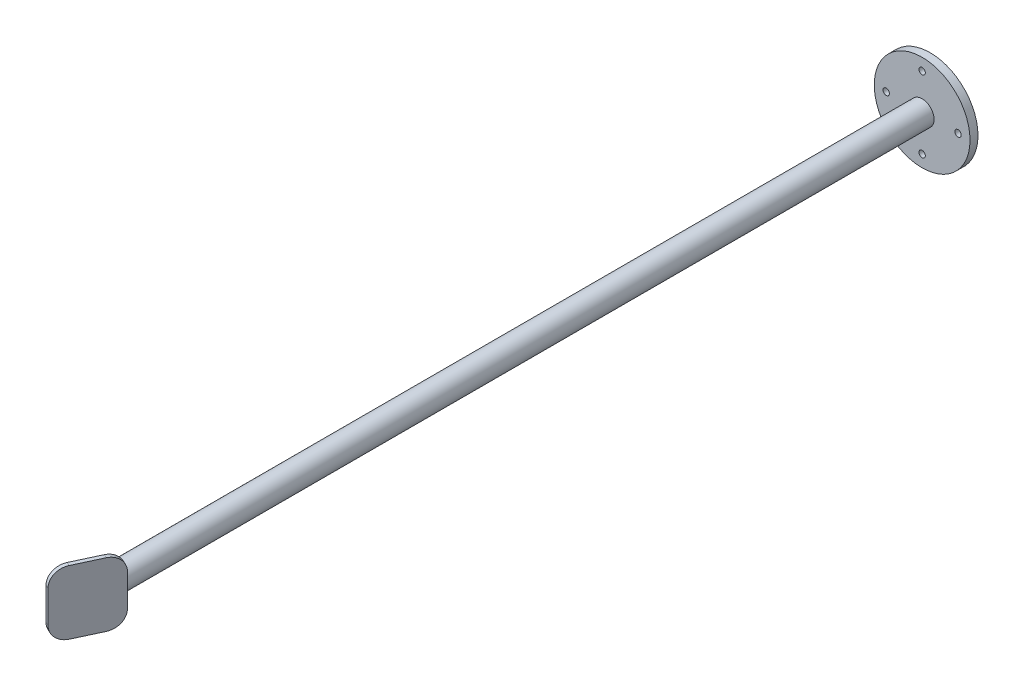
from build123d import *

# Parameters (mm, degrees)
SKETCH1_R           = 60
SKETCH1_R_2         = 4
BOSS_EXTRUDE1_DEPTH = 10
SKETCH2_R           = 15
BOSS_EXTRUDE2_DEPTH = 1080
CUT_EXTRUDE1_REACH  = 1017.827
SKETCH4_W           = 30
SKETCH4_H           = 150
BOSS_EXTRUDE3_DEPTH = 5


with BuildPart() as part:
    # Sketch1 → Boss-Extrude1 (new body)
    with BuildSketch(Plane.XY):
        Circle(SKETCH1_R)
        with Locations((0, 45)):
            Circle(SKETCH1_R_2, mode=Mode.SUBTRACT)
        with Locations((45, 0)):
            Circle(SKETCH1_R_2, mode=Mode.SUBTRACT)
        with Locations((0, -45)):
            Circle(SKETCH1_R_2, mode=Mode.SUBTRACT)
        with Locations((-45, 0)):
            Circle(SKETCH1_R_2, mode=Mode.SUBTRACT)
    extrude(amount=BOSS_EXTRUDE1_DEPTH)

    # Sketch2 → Boss-Extrude2 (add)
    with BuildSketch(Plane.XY.offset(10)):
        Circle(SKETCH2_R)
    extrude(amount=BOSS_EXTRUDE2_DEPTH)

    # Sketch4 → Cut-Extrude1 (cut, up to next)
    with BuildSketch(Plane(origin=(405.173314427, 0, 188.935419397), x_dir=(0, -1, 0), z_dir=(0.906307787036651, 0, 0.4226182617406972)), mode=Mode.PRIVATE) as cut_extrude1_sk1:
        with Locations((0, -987.87548787)):
            Rectangle(SKETCH4_W, SKETCH4_H)
    cut_extrude1_tool1 = extrude(cut_extrude1_sk1.sketch, amount=CUT_EXTRUDE1_REACH, mode=Mode.PRIVATE) & part.part
    add(cut_extrude1_tool1.solids().sort_by_distance((-12.320907, 0, 1084.254667))[0], mode=Mode.SUBTRACT)

    # Sketch5 → Boss-Extrude3 (add)
    with BuildSketch(Plane(origin=(405.173314427, 0, 188.935419397), x_dir=(0.42261826174069705, 0, -0.906307787036651), z_dir=(0.906307787036651, 0, 0.42261826174069705))):
        with BuildLine():
            Line((-941.221738049, -40), (-976.221738049, -40))
            ThreePointArc((-976.221738049, -40), (-990.363873672, -34.142135624), (-996.221738049, -20))
            Line((-996.221738049, -20), (-996.221738049, 20))
            ThreePointArc((-996.221738049, 20), (-990.363873672, 34.142135624), (-976.221738049, 40))
            Line((-976.221738049, 40), (-941.221738049, 40))
            ThreePointArc((-941.221738049, 40), (-927.079602425, 34.142135624), (-921.221738049, 20))
            Line((-921.221738049, 20), (-921.221738049, -20))
            ThreePointArc((-921.221738049, -20), (-927.079602425, -34.142135624), (-941.221738049, -40))
        make_face()
    extrude(amount=BOSS_EXTRUDE3_DEPTH)


solid = part.part
